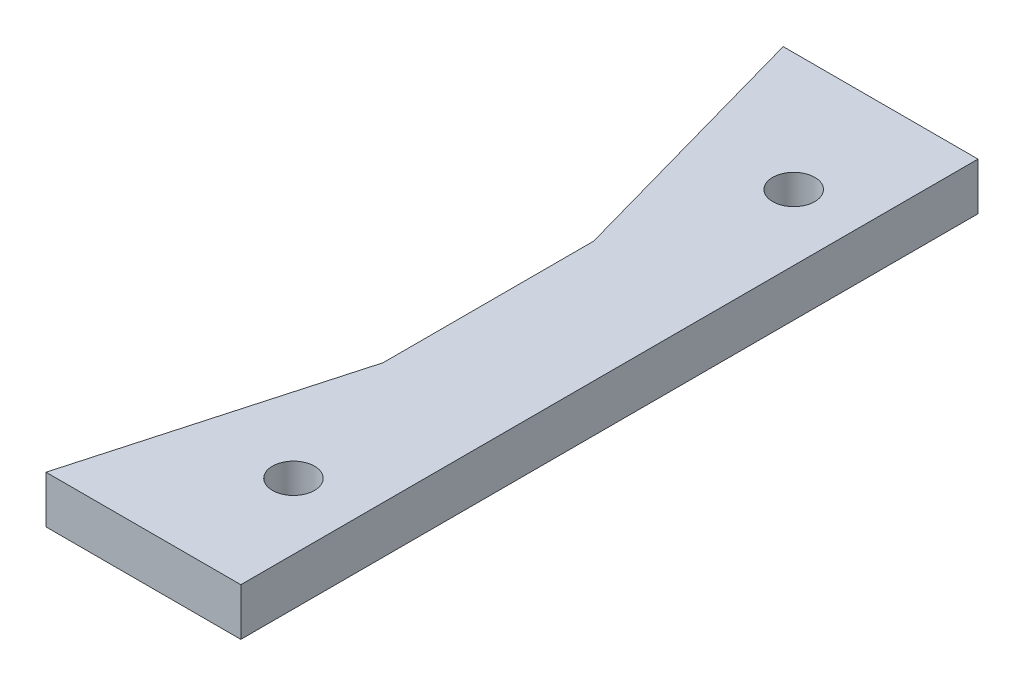
from build123d import *

# Parameters (mm, degrees)
SKETCH1_R           = 4
BOSS_EXTRUDE1_DEPTH = 9


with BuildPart() as part:
    # Sketch1 → Boss-Extrude1 (new body)
    with BuildSketch(Plane(origin=(0, 0, 0), x_dir=(1, 0, 0), z_dir=(0, 1, 0))):
        Polygon((0, 70), (0, -70), (-37, -70), (-23, -20), (-23, 0), (-23, 20), (-37, 70), align=None)
        with Locations(Location((-12.5, 47.5, 0), (0, 0, 270))):
            Circle(SKETCH1_R, mode=Mode.SUBTRACT)
        with Locations(Location((-12.5, -47.5, 0), (0, 0, 270))):
            Circle(SKETCH1_R, mode=Mode.SUBTRACT)
    extrude(amount=BOSS_EXTRUDE1_DEPTH)


solid = part.part
